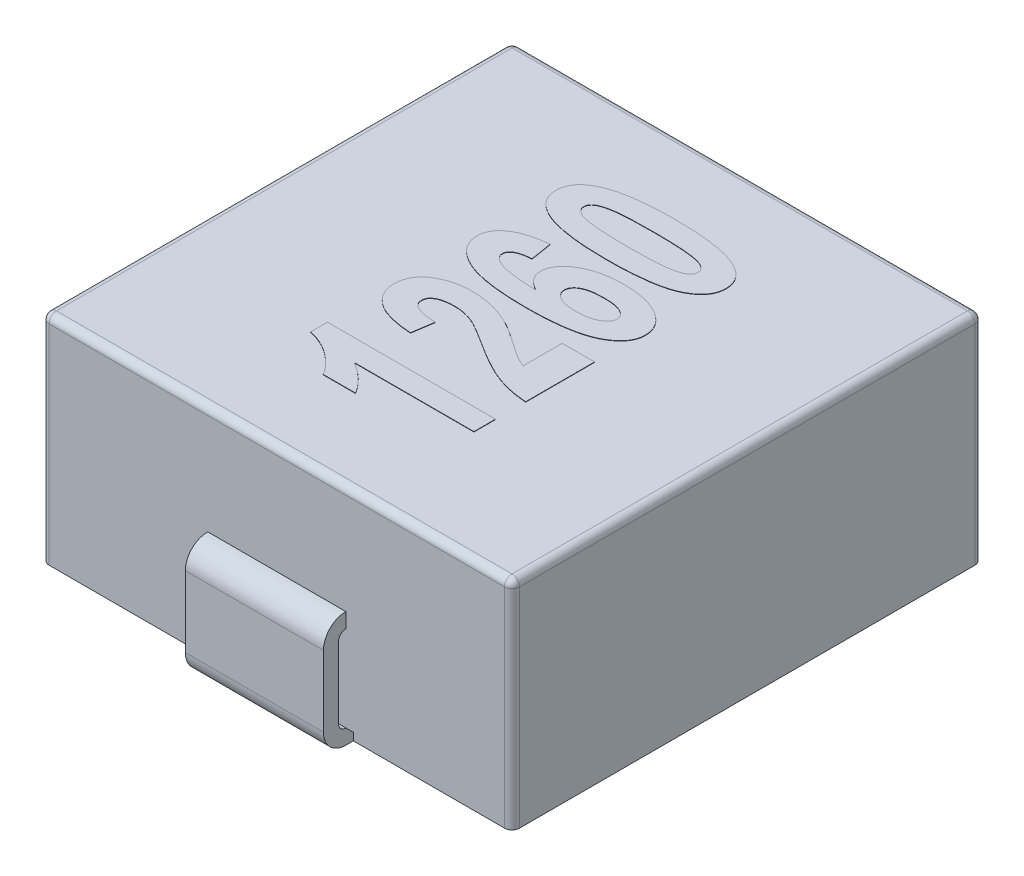
from build123d import *

# Parameters (mm, degrees)
EXTRUDE_1_DEPTH     = 5.8
SKETCH_2_W          = 4.1
SKETCH_2_H          = 3.2
CUT_EXTRUDE_1_DEPTH = 0.2
EXTRUDE_1_2_DEPTH   = 1.85
EXTRUDE_2_DEPTH     = 1.85
FILLET_1_R          = 0.2
EXTRUDE_2_2_DEPTH   = 0.01


with BuildPart() as part:
    # Эскиз1 → Extrude 1 (new body)
    with BuildSketch(Plane(origin=(0, 0, 0), x_dir=(1, 0, 0), z_dir=(0, 1, 0))):
        with BuildLine():
            Line((-6.1, -6.3), (6.1, -6.3))
            ThreePointArc((6.1, -6.3), (6.241421356, -6.241421356), (6.3, -6.1))
            Line((6.3, -6.1), (6.3, 6.1))
            ThreePointArc((6.3, 6.1), (6.241421356, 6.241421356), (6.1, 6.3))
            Line((6.1, 6.3), (-6.1, 6.3))
            ThreePointArc((-6.1, 6.3), (-6.241421356, 6.241421356), (-6.3, 6.1))
            Line((-6.3, 6.1), (-6.3, -6.1))
            ThreePointArc((-6.3, -6.1), (-6.241421356, -6.241421356), (-6.1, -6.3))
        make_face()
    extrude(amount=EXTRUDE_1_DEPTH)

    # Эскиз2 → Вырез-Вытянуть1 (cut)
    with BuildSketch(Plane.XZ):
        with Locations((0, 4.7)):
            Rectangle(SKETCH_2_W, SKETCH_2_H)
        with Locations((0, -4.7)):
            Rectangle(SKETCH_2_W, SKETCH_2_H)
    extrude(amount=-CUT_EXTRUDE_1_DEPTH, mode=Mode.SUBTRACT)

    # Эскиз3 → Extrude 1 2 (add, symmetric)
    with BuildSketch(Plane(origin=(0, 0, 0), x_dir=(0, 0, -1), z_dir=(1, 0, 0))):
        with BuildLine():
            ThreePointArc((-6.3, 2.9), (-6.724264069, 2.724264069), (-6.9, 2.3))
            Line((-6.9, 2.3), (-6.9, 0.4))
            ThreePointArc((-6.9, 0.4), (-6.724264069, -0.024264069), (-6.3, -0.2))
            Line((-6.3, -0.2), (-3.8, -0.2))
            Line((-3.8, -0.2), (-3.8, 0.2))
            Line((-3.8, 0.2), (-6.3, 0.2))
            ThreePointArc((-6.3, 0.2), (-6.441421356, 0.258578644), (-6.5, 0.4))
            Line((-6.5, 0.4), (-6.5, 2.3))
            ThreePointArc((-6.5, 2.3), (-6.441421356, 2.441421356), (-6.3, 2.5))
            Line((-6.3, 2.5), (-6.3, 2.9))
        make_face()
    extrude(amount=EXTRUDE_1_2_DEPTH, both=True)

    # Эскиз3<3> → Extrude 2 (add, symmetric)
    with BuildSketch(Plane(origin=(0, 0, 0), x_dir=(0, 0, -1), z_dir=(1, 0, 0))):
        with BuildLine():
            ThreePointArc((6.3, 2.9), (6.724264069, 2.724264069), (6.9, 2.3))
            Line((6.9, 2.3), (6.9, 0.4))
            ThreePointArc((6.9, 0.4), (6.724264069, -0.024264069), (6.3, -0.2))
            Line((6.3, -0.2), (3.8, -0.2))
            Line((3.8, -0.2), (3.8, 0.1))
            Line((3.8, 0.1), (6.3, 0.1))
            ThreePointArc((6.3, 0.1), (6.512132034, 0.187867966), (6.6, 0.4))
            Line((6.6, 0.4), (6.6, 2.3))
            ThreePointArc((6.6, 2.3), (6.512132034, 2.512132034), (6.3, 2.6))
            Line((6.3, 2.6), (6.3, 2.9))
        make_face()
    extrude(amount=EXTRUDE_2_DEPTH, both=True)

    # Скругление1
    fillet_1_edges = [part.edges().sort_by_distance(p)[0] for p in [
        (-6.241421356, 5.8, 6.241421356),
        (-6.3, 5.8, 0),
        (-6.241421356, 5.8, -6.241421356),
        (0, 5.8, -6.3),
        (6.241421356, 5.8, -6.241421356),
        (6.3, 5.8, 0),
        (6.241421356, 5.8, 6.241421356),
        (0, 5.8, 6.3),
    ]]
    fillet(fillet_1_edges, radius=FILLET_1_R)

    # Эскиз4 → Extrude 2 2 (add)
    # profile 1 of 4: a face of its own
    with BuildSketch(Plane(origin=(0, 5.8, 0), x_dir=(1, 0, 0), z_dir=(0, 1, 0))):
        with BuildLine():
            Line((2.3, -2.742307692), (2.3, -3.319230769))
            Line((2.3, -3.319230769), (-0.903725962, -3.319230769))
            add(Edge.make_bspline(
                [(-0.903725962, -3.319230769), (-0.86406372, -3.343713677), (-0.786078708, -3.391852658), (-0.675919252, -3.470855691), (-0.573321827, -3.552688159), (-0.478055637, -3.637116831), (-0.392438312, -3.726154518), (-0.313650575, -3.817422523), (-0.241646265, -3.911528035), (-0.200936704, -3.978406796), (-0.180769231, -4.011538462)],
                knots=[0, 0, 0, 0, 1.105827385, 2.17430884, 3.214432552, 4.219349929, 5.192600286, 6.143147108, 7.080117071, 8, 8, 8, 8], degree=3))
            Line((-0.180769231, -4.011538462), (-1.046153846, -4.011538462))
            add(Edge.make_bspline(
                [(-1.046153846, -4.011538462), (-1.068012691, -3.973910311), (-1.114805226, -3.893360922), (-1.211368323, -3.778972532), (-1.3302216, -3.658579268), (-1.471776622, -3.536727787), (-1.631879563, -3.420391895), (-1.808442443, -3.321497819), (-1.998820885, -3.243911517), (-2.132228541, -3.20897421), (-2.2, -3.191225962)],
                knots=[0, 0, 0, 0, 0.717406847, 1.535730084, 2.462009094, 3.510396949, 4.616124579, 5.724576378, 6.844078492, 8, 8, 8, 8], degree=3))
            Line((-2.2, -3.191225962), (-2.2, -2.742307692))
            Line((-2.2, -2.742307692), (2.3, -2.742307692))
        make_face()
    # profile 2 of 4: a face of its own
    with BuildSketch(Plane(origin=(0, 5.8, 0), x_dir=(1, 0, 0), z_dir=(0, 1, 0))):
        with BuildLine():
            Line((1.434615385, -0.088461538), (2.3, -0.088461538))
            Line((2.3, -0.088461538), (2.3, -1.934615385))
            add(Edge.make_bspline(
                [(2.3, -1.934615385), (2.226259979, -1.928455358), (2.079932751, -1.916231606), (1.864264437, -1.879545312), (1.654338523, -1.82897304), (1.482179213, -1.774531346), (1.342517386, -1.720494417), (1.230154314, -1.670293389), (1.108989011, -1.613191077), (0.981052538, -1.544184217), (0.843567642, -1.469285953), (0.697876089, -1.38518046), (0.545110167, -1.291176511), (0.44084456, -1.225007711), (0.387139423, -1.190925481)],
                knots=[0, 0, 0, 0, 1.2811081, 2.542187998, 3.784214526, 5.018585627, 5.666093998, 6.376792336, 7.149597247, 7.985321744, 8.893657631, 9.861256989, 10.89837609, 12, 12, 12, 12], degree=3))
            add(Edge.make_bspline(
                [(0.387139423, -1.190925481), (0.34421776, -1.163508022), (0.262509471, -1.111314479), (0.144848303, -1.037769714), (0.037849474, -0.973397862), (-0.057912951, -0.915924757), (-0.143416097, -0.867500526), (-0.217924559, -0.826603489), (-0.281986303, -0.794697701), (-0.321628324, -0.777618527), (-0.339423077, -0.769951923)],
                knots=[0, 0, 0, 0, 1.454327433, 2.768546135, 3.961926122, 5.019930819, 5.957524631, 6.767609832, 7.446797167, 8, 8, 8, 8], degree=3))
            add(Edge.make_bspline(
                [(-0.339423077, -0.769951923), (-0.383016183, -0.753744776), (-0.468449265, -0.721982266), (-0.599671217, -0.690011543), (-0.729653911, -0.668849496), (-0.816505367, -0.666532893), (-0.859555288, -0.665384615)],
                knots=[0, 0, 0, 0, 1.045072882, 2.048117354, 3.032504461, 4, 4, 4, 4], degree=3))
            add(Edge.make_bspline(
                [(-0.859555288, -0.665384615), (-0.904382267, -0.666329325), (-0.988621083, -0.668104621), (-1.107026047, -0.683486123), (-1.209631952, -0.707429633), (-1.295525479, -0.743169171), (-1.36365812, -0.788165168), (-1.414633234, -0.841526964), (-1.444123359, -0.905855704), (-1.448023453, -0.951464858), (-1.45, -0.974579327)],
                knots=[0, 0, 0, 0, 1.458031234, 2.739930902, 3.878203939, 4.877043568, 5.750258799, 6.518463336, 7.249165373, 8, 8, 8, 8], degree=3))
            add(Edge.make_bspline(
                [(-1.45, -0.974579327), (-1.448124787, -0.99744213), (-1.444379752, -1.043101988), (-1.412316203, -1.107285885), (-1.358981262, -1.16089113), (-1.301710372, -1.198583705), (-1.245570667, -1.223852816), (-1.195272126, -1.241814151), (-1.138142946, -1.25666623), (-1.07506762, -1.270447388), (-1.005151096, -1.280803325), (-0.928835815, -1.290019186), (-0.845496357, -1.296013356), (-0.787746666, -1.298635416), (-0.757692308, -1.3)],
                knots=[0, 0, 0, 0, 0.977985299, 1.953158208, 3.002652506, 4.194234773, 4.875468122, 5.642662911, 6.484547082, 7.408173722, 8.41360214, 9.517816347, 10.70821063, 12, 12, 12, 12], degree=3))
            Line((-0.757692308, -1.3), (-0.842427885, -1.876923077))
            add(Edge.make_bspline(
                [(-0.842427885, -1.876923077), (-0.900790166, -1.872787934), (-1.013597383, -1.864795205), (-1.175860423, -1.842301441), (-1.325797604, -1.81655978), (-1.462505274, -1.78157562), (-1.587001932, -1.742797624), (-1.699002653, -1.697014574), (-1.797491889, -1.643634289), (-1.884194828, -1.585022897), (-1.958258656, -1.520238872), (-2.023168768, -1.452496054), (-2.077523352, -1.380070687), (-2.121814978, -1.303653792), (-2.157836951, -1.224217332), (-2.181631805, -1.140000853), (-2.198011494, -1.052442493), (-2.199331334, -0.992385559), (-2.2, -0.961959135)],
                knots=[0, 0, 0, 0, 1.543052601, 2.982533657, 4.319726036, 5.554018453, 6.702197742, 7.757705268, 8.740201395, 9.652663645, 10.512474517, 11.331142406, 12.123838954, 12.894713421, 13.657722452, 14.41776096, 15.198396027, 16, 16, 16, 16], degree=3))
            add(Edge.make_bspline(
                [(-2.2, -0.961959135), (-2.198982407, -0.928846362), (-2.196989872, -0.864008682), (-2.180711132, -0.769292784), (-2.152134534, -0.680610173), (-2.114759461, -0.596533247), (-2.063764008, -0.519388573), (-2.003533973, -0.446804567), (-1.930994508, -0.380789266), (-1.849336408, -0.320068584), (-1.759604484, -0.265002951), (-1.662651814, -0.218986675), (-1.561650561, -0.177463388), (-1.45449893, -0.14580066), (-1.342728183, -0.118980287), (-1.225079427, -0.10158587), (-1.102262588, -0.090399872), (-1.018535557, -0.089116141), (-0.975841346, -0.088461538)],
                knots=[0, 0, 0, 0, 0.94559895, 1.851564729, 2.733839678, 3.601929286, 4.470952004, 5.366653288, 6.289938494, 7.265036351, 8.270490059, 9.29164925, 10.327707252, 11.386659859, 12.479746171, 13.60874177, 14.780646081, 16, 16, 16, 16], degree=3))
            add(Edge.make_bspline(
                [(-0.975841346, -0.088461538), (-0.926828777, -0.088961464), (-0.829835872, -0.089950787), (-0.686379789, -0.103669209), (-0.546190423, -0.122572898), (-0.408826845, -0.152365575), (-0.271570531, -0.189521503), (-0.132247162, -0.23586617), (0.01025162, -0.291478564), (0.104620374, -0.335522779), (0.152764423, -0.357992788)],
                knots=[0, 0, 0, 0, 1.004329526, 1.987507276, 2.95182621, 3.902593765, 4.866381389, 5.865635833, 6.911112759, 8, 8, 8, 8], degree=3))
            add(Edge.make_bspline(
                [(0.152764423, -0.357992788), (0.169929347, -0.366633074), (0.206308686, -0.384945295), (0.263291276, -0.415609421), (0.325140461, -0.452001549), (0.393329041, -0.492252782), (0.465660788, -0.539639465), (0.544377258, -0.59043888), (0.627124816, -0.648103678), (0.714191366, -0.707132472), (0.79900291, -0.76751791), (0.879157039, -0.822186323), (0.951637889, -0.871068525), (1.016071339, -0.9142996), (1.073174748, -0.951085472), (1.12170891, -0.983026341), (1.163082139, -1.008498454), (1.227550781, -1.043677512), (1.315771938, -1.088200239), (1.395877139, -1.118554224), (1.434615385, -1.133233173)],
                knots=[0, 0, 0, 0, 0.691072229, 1.464658443, 2.326494152, 3.271626232, 4.31174875, 5.435668429, 6.640564959, 7.938400603, 9.218480418, 10.38441876, 11.427400072, 12.362471323, 13.174714386, 13.870081907, 14.45199856, 14.921154764, 16.51109466, 18, 18, 18, 18], degree=3))
            Line((1.434615385, -1.133233173), (1.434615385, -0.088461538))
        make_face()
    # profile 3 of 4: a face of its own
    with BuildSketch(Plane(origin=(0, 5.8, 0), x_dir=(1, 0, 0), z_dir=(0, 1, 0))):
        with BuildLine():
            Line((-1.025420673, 2.046153846), (-0.930769231, 1.469230769))
            add(Edge.make_bspline(
                [(-0.930769231, 1.469230769), (-0.972340226, 1.4661706), (-1.049910574, 1.460460408), (-1.157174554, 1.440055971), (-1.247856947, 1.415296635), (-1.321663877, 1.382272569), (-1.378003952, 1.341966512), (-1.420178112, 1.297202187), (-1.445275507, 1.244335075), (-1.44841752, 1.206856772), (-1.45, 1.187980769)],
                knots=[0, 0, 0, 0, 1.547933539, 2.888401903, 4.051160049, 5.035482248, 5.875421366, 6.610865063, 7.300360132, 8, 8, 8, 8], degree=3))
            add(Edge.make_bspline(
                [(-1.45, 1.187980769), (-1.449443494, 1.175244014), (-1.448315519, 1.149428067), (-1.434477059, 1.112283174), (-1.414505103, 1.076372941), (-1.385805032, 1.042706611), (-1.349008077, 1.011532093), (-1.305467558, 0.980150049), (-1.252734132, 0.952409277), (-1.192202942, 0.922888412), (-1.11796075, 0.897949177), (-1.028826206, 0.874820308), (-0.92280488, 0.854458681), (-0.80035984, 0.836748124), (-0.661389566, 0.821929901), (-0.506043624, 0.808242179), (-0.333807848, 0.797577857), (-0.213232659, 0.792895559), (-0.150120192, 0.790444712)],
                knots=[0, 0, 0, 0, 0.421197778, 0.853719783, 1.300746273, 1.78264306, 2.313265115, 2.900503073, 3.561819606, 4.289782765, 5.1359559, 6.157823296, 7.348229895, 8.720567648, 10.26734187, 11.990994611, 13.901573116, 16, 16, 16, 16], degree=3))
            add(Edge.make_bspline(
                [(-0.150120192, 0.790444712), (-0.179940301, 0.806971219), (-0.237279539, 0.838749015), (-0.313991814, 0.894180019), (-0.379713607, 0.951481072), (-0.432957379, 1.012874483), (-0.474880869, 1.077029495), (-0.505571947, 1.144628109), (-0.522861211, 1.215972101), (-0.525563429, 1.264516644), (-0.526923077, 1.288942308)],
                knots=[0, 0, 0, 0, 1.242166581, 2.388485101, 3.443968908, 4.414915599, 5.341837397, 6.229596128, 7.10920388, 8, 8, 8, 8], degree=3))
            add(Edge.make_bspline(
                [(-0.526923077, 1.288942308), (-0.525630114, 1.316373366), (-0.523058706, 1.370927499), (-0.504699277, 1.451548957), (-0.472274784, 1.5286052), (-0.428683783, 1.602897264), (-0.373068149, 1.674315219), (-0.303156187, 1.740454909), (-0.223001829, 1.805876782), (-0.130333131, 1.866386926), (-0.028358315, 1.921658973), (0.081530143, 1.970808238), (0.198914378, 2.011945559), (0.323253164, 2.046191518), (0.454886029, 2.072555498), (0.593537765, 2.089540753), (0.739369973, 2.102274903), (0.839032203, 2.103313504), (0.890144231, 2.103846154)],
                knots=[0, 0, 0, 0, 0.734007909, 1.459774749, 2.199050725, 2.963192626, 3.759539057, 4.612625619, 5.53328027, 6.525872703, 7.569509258, 8.635131787, 9.744147816, 10.895287489, 12.084509423, 13.333418657, 14.632436985, 16, 16, 16, 16], degree=3))
            add(Edge.make_bspline(
                [(0.890144231, 2.103846154), (0.944252507, 2.103260058), (1.049599592, 2.102118948), (1.203716501, 2.090176223), (1.349354804, 2.070437397), (1.487132969, 2.043803098), (1.616251537, 2.008424199), (1.737636274, 1.966349002), (1.850898046, 1.91591254), (1.954736195, 1.85717867), (2.049753913, 1.794466674), (2.131048152, 1.724140626), (2.201451672, 1.651212907), (2.259126249, 1.573344343), (2.302657795, 1.490052527), (2.334634604, 1.402890669), (2.354206297, 1.310839439), (2.356518998, 1.247871285), (2.357692308, 1.215925481)],
                knots=[0, 0, 0, 0, 1.367116428, 2.66173203, 3.903124256, 5.079558343, 6.205046213, 7.283309711, 8.323358666, 9.333028085, 10.295481398, 11.194852953, 12.043460734, 12.852948912, 13.634165077, 14.410049153, 15.19336591, 16, 16, 16, 16], degree=3))
            add(Edge.make_bspline(
                [(2.357692308, 1.215925481), (2.356179345, 1.181525036), (2.35319352, 1.113635896), (2.327837378, 1.014364648), (2.285570879, 0.920512292), (2.226892421, 0.831341726), (2.151914097, 0.747067594), (2.060752054, 0.667663766), (1.953600766, 0.592594208), (1.829169621, 0.523278107), (1.686259544, 0.459496055), (1.522803208, 0.405365029), (1.338569053, 0.359770417), (1.13349829, 0.32246302), (0.907266874, 0.292907534), (0.659967165, 0.272981757), (0.392081458, 0.260209312), (0.206566238, 0.258551635), (0.110396635, 0.257692308)],
                knots=[0, 0, 0, 0, 0.617569667, 1.218771255, 1.827972511, 2.460081808, 3.129675276, 3.849054116, 4.628164937, 5.476881715, 6.405213646, 7.436718353, 8.567082883, 9.813797292, 11.18098149, 12.665915498, 14.271637317, 16, 16, 16, 16], degree=3))
            add(Edge.make_bspline(
                [(0.110396635, 0.257692308), (0.011828459, 0.258614592), (-0.178481948, 0.26039529), (-0.453390667, 0.272346585), (-0.706868726, 0.294977862), (-0.938845228, 0.325133353), (-1.14970681, 0.363312651), (-1.339353873, 0.410537268), (-1.507975164, 0.466652899), (-1.655399757, 0.532764911), (-1.782977675, 0.606354584), (-1.894302524, 0.683524544), (-1.988072298, 0.76711586), (-2.066015344, 0.855339965), (-2.125508749, 0.950620137), (-2.168025828, 1.050666093), (-2.196017616, 1.155821233), (-2.198662492, 1.228068234), (-2.2, 1.264603365)],
                knots=[0, 0, 0, 0, 1.712881794, 3.307144821, 4.780208204, 6.133850414, 7.371026634, 8.501944807, 9.527360037, 10.455174248, 11.304257444, 12.08365796, 12.804786361, 13.482166175, 14.122551618, 14.747159899, 15.36644182, 16, 16, 16, 16], degree=3))
            add(Edge.make_bspline(
                [(-2.2, 1.264603365), (-2.199228609, 1.290217272), (-2.197700327, 1.340963611), (-2.182680652, 1.414883482), (-2.159188477, 1.485681118), (-2.12524708, 1.552188719), (-2.083418113, 1.616628466), (-2.030960432, 1.6766646), (-1.968626792, 1.7326388), (-1.898486425, 1.78611442), (-1.818339785, 1.834462311), (-1.730338714, 1.879681848), (-1.6332794, 1.918979046), (-1.528223997, 1.954187275), (-1.414789548, 1.984868744), (-1.292374946, 2.009382062), (-1.16203574, 2.031706807), (-1.071763609, 2.041253082), (-1.025420673, 2.046153846)],
                knots=[0, 0, 0, 0, 0.793614411, 1.572310967, 2.329801053, 3.100930466, 3.881632539, 4.707591256, 5.565282481, 6.4768378, 7.439156986, 8.46458458, 9.542909719, 10.68356117, 11.899952641, 13.18500309, 14.554867148, 16, 16, 16, 16], degree=3))
        make_face()
        with BuildLine():
            add(Edge.make_bspline(
                [(0.8703125, 0.834615385), (0.925968648, 0.835910184), (1.030804314, 0.83834911), (1.178307603, 0.858527813), (1.305953099, 0.89307635), (1.413104274, 0.940955924), (1.497309821, 0.999589429), (1.560055035, 1.061689763), (1.600840004, 1.130311075), (1.605447614, 1.17939367), (1.607692308, 1.203305288)],
                knots=[0, 0, 0, 0, 1.487550157, 2.801996091, 3.96948146, 5.011955507, 5.923443518, 6.696061968, 7.364759143, 8, 8, 8, 8], degree=3))
            add(Edge.make_bspline(
                [(1.607692308, 1.203305288), (1.605871383, 1.225921022), (1.602232628, 1.271114069), (1.569138695, 1.333898688), (1.518708794, 1.390379272), (1.461264733, 1.428976878), (1.406549813, 1.457203758), (1.357488303, 1.475811691), (1.302444623, 1.49227032), (1.240712907, 1.504076727), (1.173204408, 1.515416988), (1.099108614, 1.52234599), (1.018777873, 1.525485515), (0.963163341, 1.526432076), (0.934314904, 1.526923077)],
                knots=[0, 0, 0, 0, 0.98415851, 1.96664515, 3.038345339, 4.2755351, 4.969759699, 5.731949388, 6.568604871, 7.481899529, 8.481065577, 9.564888458, 10.736856013, 12, 12, 12, 12], degree=3))
            add(Edge.make_bspline(
                [(0.934314904, 1.526923077), (0.904563259, 1.52651017), (0.847128467, 1.525713064), (0.764077292, 1.52151692), (0.687393103, 1.513316338), (0.616715441, 1.502461766), (0.552050345, 1.489595022), (0.493582005, 1.472252276), (0.441359188, 1.451739949), (0.382240419, 1.421505989), (0.320088981, 1.37972672), (0.265320647, 1.319034038), (0.228974893, 1.251340433), (0.225046131, 1.202530056), (0.223076923, 1.178064904)],
                knots=[0, 0, 0, 0, 1.22920971, 2.372957979, 3.434023047, 4.413685549, 5.326664308, 6.15541423, 6.929955182, 7.640580054, 8.897558011, 9.996505919, 10.995791649, 12, 12, 12, 12], degree=3))
            add(Edge.make_bspline(
                [(0.223076923, 1.178064904), (0.224904612, 1.154582977), (0.228582062, 1.10733556), (0.262046727, 1.040697816), (0.316251868, 0.982518024), (0.388124458, 0.928653653), (0.48142836, 0.886036699), (0.594167675, 0.8563949), (0.725757321, 0.837533733), (0.820059573, 0.835629915), (0.8703125, 0.834615385)],
                knots=[0, 0, 0, 0, 0.695405127, 1.39920786, 2.165432477, 3.046964329, 4.054821068, 5.195738149, 6.505630974, 8, 8, 8, 8], degree=3))
        make_face(mode=Mode.SUBTRACT)
    # profile 4 of 4: a face of its own
    with BuildSketch(Plane(origin=(0, 5.8, 0), x_dir=(1, 0, 0), z_dir=(0, 1, 0))):
        with BuildLine():
            add(Edge.make_bspline(
                [(-2.2, 3.373076923), (-2.198632169, 3.406541916), (-2.195928524, 3.472688596), (-2.17393791, 3.568726795), (-2.136916941, 3.658842095), (-2.086178151, 3.743333936), (-2.019630612, 3.82175966), (-1.93940296, 3.894544409), (-1.844081195, 3.960844007), (-1.774024563, 3.998769435), (-1.737560096, 4.018509615)],
                knots=[0, 0, 0, 0, 0.955393409, 1.888424153, 2.797124692, 3.72908846, 4.691973758, 5.725088377, 6.815908799, 8, 8, 8, 8], degree=3))
            add(Edge.make_bspline(
                [(-1.737560096, 4.018509615), (-1.688355572, 4.041073742), (-1.584699181, 4.088608312), (-1.412616062, 4.144296334), (-1.218811463, 4.19151313), (-1.002228214, 4.229649202), (-0.763392968, 4.260066848), (-0.501999951, 4.281119797), (-0.218151445, 4.293587412), (-0.021527785, 4.295276237), (0.080649038, 4.296153846)],
                knots=[0, 0, 0, 0, 0.700474636, 1.475650333, 2.337255432, 3.282132182, 4.32169542, 5.453938737, 6.676921928, 8, 8, 8, 8], degree=3))
            add(Edge.make_bspline(
                [(0.080649038, 4.296153846), (0.182520791, 4.295226366), (0.378835099, 4.293439045), (0.662468788, 4.281596744), (0.923349076, 4.258499807), (1.162493348, 4.230174318), (1.379097493, 4.190281083), (1.57388549, 4.143397772), (1.747085573, 4.087863144), (1.851181837, 4.03963203), (1.900661058, 4.016706731)],
                knots=[0, 0, 0, 0, 1.317670938, 2.539248156, 3.670516995, 4.704541079, 5.652850057, 6.517238681, 7.295211257, 8, 8, 8, 8], degree=3))
            add(Edge.make_bspline(
                [(1.900661058, 4.016706731), (1.936935669, 3.997421922), (2.006898176, 3.960227489), (2.099725381, 3.892762395), (2.179891364, 3.821570434), (2.244547835, 3.742937207), (2.296064174, 3.658908964), (2.331004327, 3.568073243), (2.353827489, 3.472459429), (2.356390071, 3.406563497), (2.357692308, 3.373076923)],
                knots=[0, 0, 0, 0, 1.179332592, 2.274567848, 3.289398841, 4.252461845, 5.189941122, 6.108820401, 7.038952423, 8, 8, 8, 8], degree=3))
            add(Edge.make_bspline(
                [(2.357692308, 3.373076923), (2.356111938, 3.33928105), (2.35298281, 3.272365289), (2.328568164, 3.174926845), (2.289622314, 3.082365545), (2.233152464, 2.996023915), (2.161932227, 2.914125028), (2.074642727, 2.837620286), (1.971889284, 2.766502376), (1.853110237, 2.699816718), (1.713978213, 2.639479825), (1.550761422, 2.589566752), (1.364161273, 2.545361838), (1.152570574, 2.511279448), (0.917093552, 2.483481322), (0.656912424, 2.464579075), (0.372553845, 2.451294049), (0.174716985, 2.450443287), (0.071634615, 2.45)],
                knots=[0, 0, 0, 0, 0.600476196, 1.188941655, 1.775584294, 2.378931158, 3.015403394, 3.700645778, 4.437482328, 5.234265339, 6.119850578, 7.12887988, 8.26569383, 9.528207572, 10.938146564, 12.481751003, 14.166825734, 16, 16, 16, 16], degree=3))
            add(Edge.make_bspline(
                [(0.071634615, 2.45), (-0.029637869, 2.450918877), (-0.225054234, 2.452691952), (-0.507464235, 2.464681281), (-0.767856339, 2.487258639), (-1.006124505, 2.517431937), (-1.222433593, 2.555504375), (-1.416444553, 2.602977335), (-1.589399048, 2.658262564), (-1.693491392, 2.706512751), (-1.74296875, 2.729447115)],
                knots=[0, 0, 0, 0, 1.313729961, 2.534986055, 3.665680208, 4.703219291, 5.64977019, 6.512901895, 7.293149888, 8, 8, 8, 8], degree=3))
            add(Edge.make_bspline(
                [(-1.74296875, 2.729447115), (-1.779249112, 2.74872748), (-1.849222709, 2.785913342), (-1.941973153, 2.853437761), (-2.022576181, 2.924581159), (-2.086265463, 3.003938175), (-2.138661688, 3.087358347), (-2.173259046, 3.178114815), (-2.196149009, 3.273685487), (-2.198702422, 3.33958734), (-2.2, 3.373076923)],
                knots=[0, 0, 0, 0, 1.179437609, 2.274770394, 3.289691756, 4.259516136, 5.189690891, 6.108651995, 7.038866843, 8, 8, 8, 8], degree=3))
        make_face()
        with BuildLine():
            add(Edge.make_bspline(
                [(-1.45, 3.373076923), (-1.448691519, 3.357290189), (-1.446040076, 3.325300725), (-1.426971445, 3.279330915), (-1.395629219, 3.236792632), (-1.352190569, 3.196268327), (-1.292366363, 3.159754105), (-1.214260696, 3.128942336), (-1.117650501, 3.10273304), (-1.046567152, 3.089198533), (-1.008293269, 3.081911058)],
                knots=[0, 0, 0, 0, 0.66053735, 1.338480494, 2.051183008, 2.861689582, 3.811811342, 4.969049189, 6.368024884, 8, 8, 8, 8], degree=3))
            add(Edge.make_bspline(
                [(-1.008293269, 3.081911058), (-0.979167601, 3.077558059), (-0.916238503, 3.068152942), (-0.814682115, 3.056335709), (-0.698844576, 3.048172735), (-0.569688705, 3.039423533), (-0.426574114, 3.034869929), (-0.270040009, 3.029983029), (-0.099347104, 3.027417798), (0.019049905, 3.027092383), (0.080649038, 3.026923077)],
                knots=[0, 0, 0, 0, 0.647628605, 1.399270384, 2.247685976, 3.201110699, 4.24594481, 5.39623077, 6.6453211, 8, 8, 8, 8], degree=3))
            add(Edge.make_bspline(
                [(0.080649038, 3.026923077), (0.141946534, 3.027202681), (0.259435939, 3.027738601), (0.428037259, 3.028837785), (0.581576683, 3.033787478), (0.720391479, 3.039262629), (0.84431497, 3.044616467), (0.953025587, 3.054278395), (1.046936906, 3.063449685), (1.148697632, 3.078768311), (1.255359024, 3.099427492), (1.363071498, 3.128707949), (1.447677065, 3.159908067), (1.510270485, 3.196362159), (1.553364913, 3.237483961), (1.585926522, 3.278816493), (1.603449541, 3.325540635), (1.606287151, 3.35733344), (1.607692308, 3.373076923)],
                knots=[0, 0, 0, 0, 1.772229522, 3.396846643, 4.874325468, 6.213183949, 7.413572011, 8.459660885, 9.368179202, 10.14095794, 11.434081607, 12.506883432, 13.365124891, 14.035567992, 14.582591736, 15.079517174, 15.544185971, 16, 16, 16, 16], degree=3))
            add(Edge.make_bspline(
                [(1.607692308, 3.373076923), (1.606475274, 3.389198428), (1.604053404, 3.421279864), (1.58411044, 3.467093502), (1.553969183, 3.510217798), (1.509453595, 3.5497474), (1.450148708, 3.586486647), (1.371921102, 3.617180718), (1.275353079, 3.64343072), (1.204263054, 3.656958783), (1.165985577, 3.664242788)],
                knots=[0, 0, 0, 0, 0.672803919, 1.338864841, 2.061605897, 2.863308736, 3.813131099, 4.970004284, 6.368539142, 8, 8, 8, 8], degree=3))
            add(Edge.make_bspline(
                [(1.165985577, 3.664242788), (1.13685903, 3.668588372), (1.074223261, 3.677933418), (0.973279866, 3.689836338), (0.858339677, 3.69797886), (0.729786941, 3.706760957), (0.586970322, 3.711277379), (0.430436773, 3.716172832), (0.260044161, 3.718730831), (0.141947673, 3.719059942), (0.080649038, 3.719230769)],
                knots=[0, 0, 0, 0, 0.649769229, 1.397309303, 2.24191953, 3.191878681, 4.240166309, 5.394254338, 6.647473319, 8, 8, 8, 8], degree=3))
            add(Edge.make_bspline(
                [(0.080649038, 3.719230769), (0.019351516, 3.718952325), (-0.098137939, 3.718418628), (-0.267039275, 3.717302306), (-0.420879862, 3.712382152), (-0.55999576, 3.706901129), (-0.68421455, 3.701488179), (-0.793234467, 3.691928811), (-0.887440225, 3.682691451), (-0.988915597, 3.667464502), (-1.095258315, 3.646640888), (-1.2028883, 3.617263404), (-1.288204818, 3.586272054), (-1.351412419, 3.549648033), (-1.395864883, 3.509303603), (-1.426944145, 3.466797132), (-1.446046559, 3.420859247), (-1.448693661, 3.388865681), (-1.45, 3.373076923)],
                knots=[0, 0, 0, 0, 1.769047239, 3.390747135, 4.874240912, 6.210695287, 7.408927887, 8.461780351, 9.368667298, 10.140058405, 11.422355672, 12.493231132, 13.358012728, 14.034682899, 14.587091034, 15.078019327, 15.545004449, 16, 16, 16, 16], degree=3))
        make_face(mode=Mode.SUBTRACT)
    extrude(amount=EXTRUDE_2_2_DEPTH)


solid = part.part
